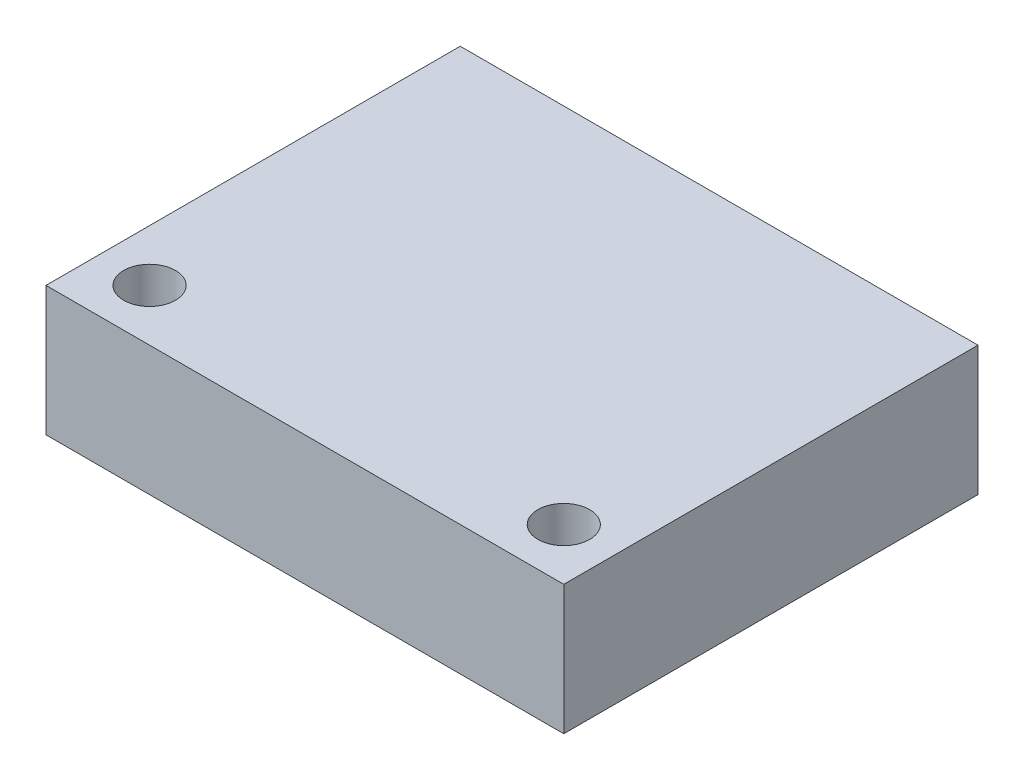
from build123d import *

# Parameters (mm, degrees)
SCHIZZO1_W                   = 20
SCHIZZO1_H                   = 16
ESTRUSIONE_ESTRUSIONE1_DEPTH = 5
SCHIZZO2_R                   = 1
TAGLIO_ESTRUSIONE1_DEPTH     = 5


with BuildPart() as part:
    # Schizzo1 → Estrusione-Estrusione1 (new body)
    with BuildSketch(Plane(origin=(0, 0, 0), x_dir=(1, 0, 0), z_dir=(0, 1, 0))):
        Rectangle(SCHIZZO1_W, SCHIZZO1_H)
    extrude(amount=ESTRUSIONE_ESTRUSIONE1_DEPTH)

    # Schizzo2 → Taglio-Estrusione1 (cut)
    with BuildSketch(Plane(origin=(0, 5, 0), x_dir=(1, 0, 0), z_dir=(0, 1, 0))):
        with Locations(Location((-8, -6, 0), (0, 0, 270))):
            Circle(SCHIZZO2_R)
        with Locations(Location((8, -6, 0), (0, 0, 270))):
            Circle(SCHIZZO2_R)
    extrude(amount=-TAGLIO_ESTRUSIONE1_DEPTH, mode=Mode.SUBTRACT)


solid = part.part
